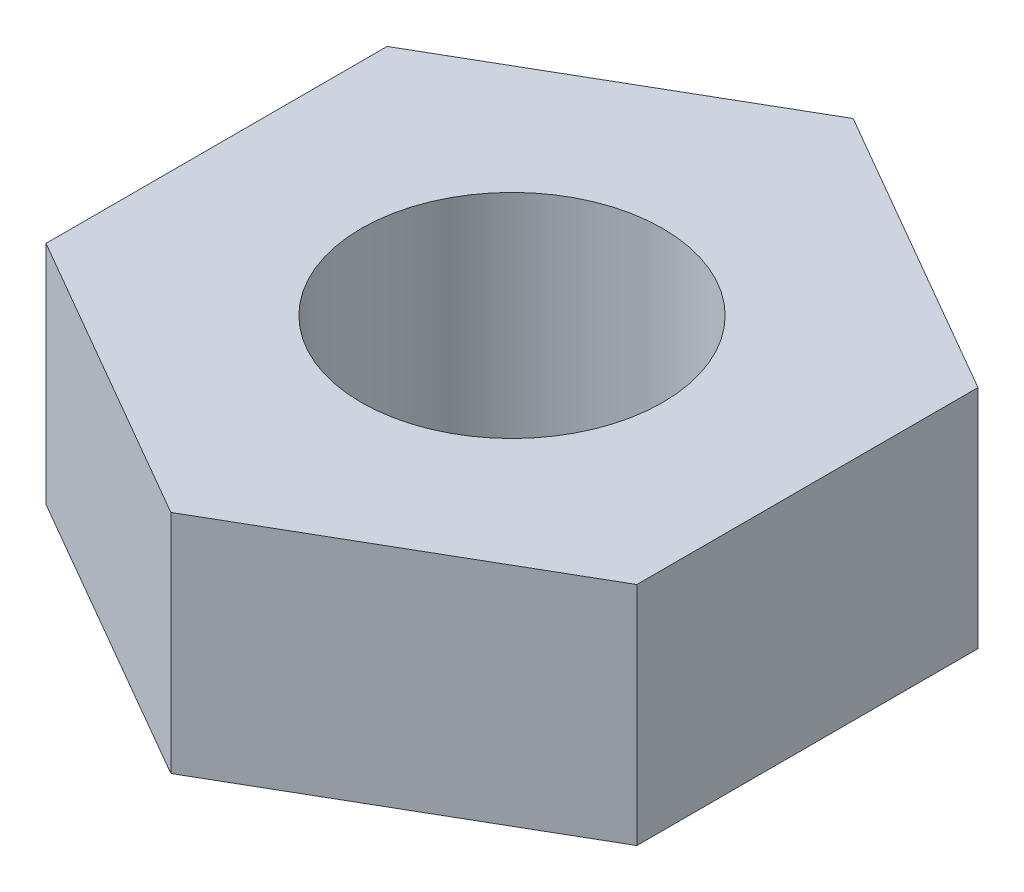
from build123d import *

# Parameters (mm, degrees)
SKETCH1_R           = 1
BOSS_EXTRUDE1_DEPTH = 1.5


with BuildPart() as part:
    # Sketch1 → Boss-Extrude1 (new body)
    with BuildSketch(Plane(origin=(0, 0, 0), x_dir=(1, 0, 0), z_dir=(0, 1, 0))):
        Polygon((0, -2.263213055), (1.96, -1.131606528), (1.96, 1.131606528), (0, 2.263213055), (-1.96, 1.131606528), (-1.96, -1.131606528), align=None)
        with Locations(Location((0, 0, 0), (0, 0, 270))):
            Circle(SKETCH1_R, mode=Mode.SUBTRACT)
    extrude(amount=BOSS_EXTRUDE1_DEPTH)


solid = part.part
